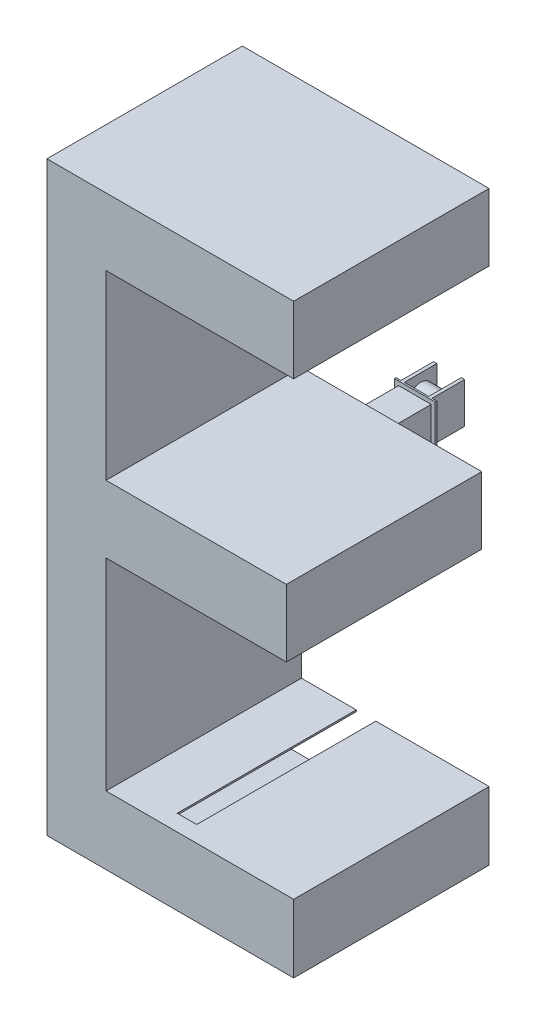
from build123d import *

# Parameters (mm, degrees)
BOSS_EXTRUDE4_DEPTH = 304.8
SHELL1_T            = -2.54
SKETCH3_W           = 50.8
SKETCH3_H           = 50.8
BOSS_EXTRUDE5_DEPTH = 381
SKETCH4_W           = 63.5
SKETCH4_H           = 63.5
BOSS_EXTRUDE6_DEPTH = 2.54
SKETCH5_W           = 5.08
SKETCH5_H           = 63.5
SKETCH5_H_2         = 63.212567158
BOSS_EXTRUDE7_DEPTH = 50.8
BOSS_EXTRUDE8_REACH = 1036.844
SKETCH6_R           = 19.05
SKETCH7_W           = 30.48
SKETCH7_H           = 279.4
CUT_EXTRUDE1_DEPTH  = 431.8


with BuildPart() as part:
    # Sketch2 → Boss-Extrude4 (new body)
    with BuildSketch(Plane.XY):
        Polygon((489.227839492, 0), (104.27186579, 0), (104.27186579, 914.4), (489.227839492, 914.4), (489.227839492, 809.506234414), (196.520335525, 809.506234414), (196.520335525, 526.127227386), (477.826343233, 526.127227386), (477.826343233, 421.2334618), (196.520335525, 421.2334618), (196.520335525, 106.34486511), (489.227839492, 106.34486511), align=None)
    extrude(amount=-BOSS_EXTRUDE4_DEPTH)

    # Shell1
    shell1_openings = [part.faces().sort_by_distance(p)[0] for p in [
        (249.504622919, 459.117899523, -304.8),
    ]]
    offset(amount=SHELL1_T, openings=shell1_openings, kind=Kind.INTERSECTION)

    # Sketch3 → Boss-Extrude5 (add)
    with BuildSketch(Plane(origin=(0, 0, -2.54), x_dir=(-1, 0, 0), z_dir=(0, 0, -1))):
        with Locations((-294.77186579, 473.328769938)):
            Rectangle(SKETCH3_W, SKETCH3_H)
    extrude(amount=BOSS_EXTRUDE5_DEPTH)

    # Sketch4 → Boss-Extrude6 (add)
    with BuildSketch(Plane(origin=(0, 0, -383.54), x_dir=(-1, 0, 0), z_dir=(0, 0, -1))):
        with Locations((-294.77186579, 473.328769938)):
            Rectangle(SKETCH4_W, SKETCH4_H)
    extrude(amount=BOSS_EXTRUDE6_DEPTH)

    # Sketch5 → Boss-Extrude7 (add)
    with BuildSketch(Plane(origin=(0, 0, -386.08), x_dir=(-1, 0, 0), z_dir=(0, 0, -1))):
        with Locations((-316.36186579, 473.328769938)):
            Rectangle(SKETCH5_W, SKETCH5_H)
        with Locations((-273.18186579, 473.472486359)):
            Rectangle(SKETCH5_W, SKETCH5_H_2)
    extrude(amount=BOSS_EXTRUDE7_DEPTH)

    # Sketch6 → Boss-Extrude8 (add, up to next)
    with BuildSketch(Plane.ZY.offset(-313.82186579), mode=Mode.PRIVATE) as boss_extrude8_sk1:
        with Locations(Location((-411.48, 473.328769938, 0), (0, 0, 180))):
            Circle(SKETCH6_R)
    boss_extrude8_tool1 = extrude(boss_extrude8_sk1.sketch, amount=BOSS_EXTRUDE8_REACH, mode=Mode.PRIVATE) - part.part
    add(boss_extrude8_tool1.solids().sort_by_distance((313.821866, 473.32877, -411.48))[0])

    # Sketch7 → Cut-Extrude1 (cut)
    with BuildSketch(Plane.XZ):
        with Locations((297.31186579, -165.1)):
            Rectangle(SKETCH7_W, SKETCH7_H)
    extrude(amount=-CUT_EXTRUDE1_DEPTH, mode=Mode.SUBTRACT)


solid = part.part
